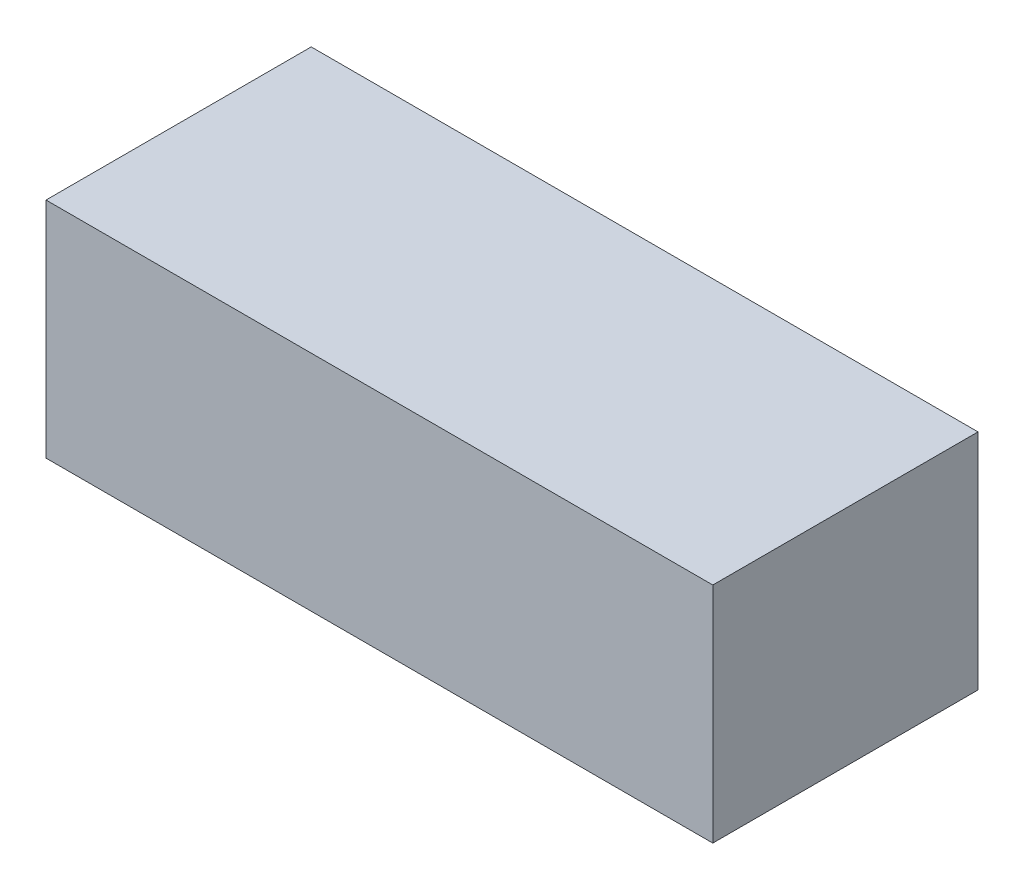
from build123d import *

# Parameters (mm, degrees)
SKETCH1_W           = 176
SKETCH1_H           = 70
BOSS_EXTRUDE1_DEPTH = 59


with BuildPart() as part:
    # Sketch1 → Boss-Extrude1 (new body)
    with BuildSketch(Plane(origin=(0, 0, 0), x_dir=(1, 0, 0), z_dir=(0, 1, 0))):
        Rectangle(SKETCH1_W, SKETCH1_H)
    extrude(amount=BOSS_EXTRUDE1_DEPTH)


solid = part.part
